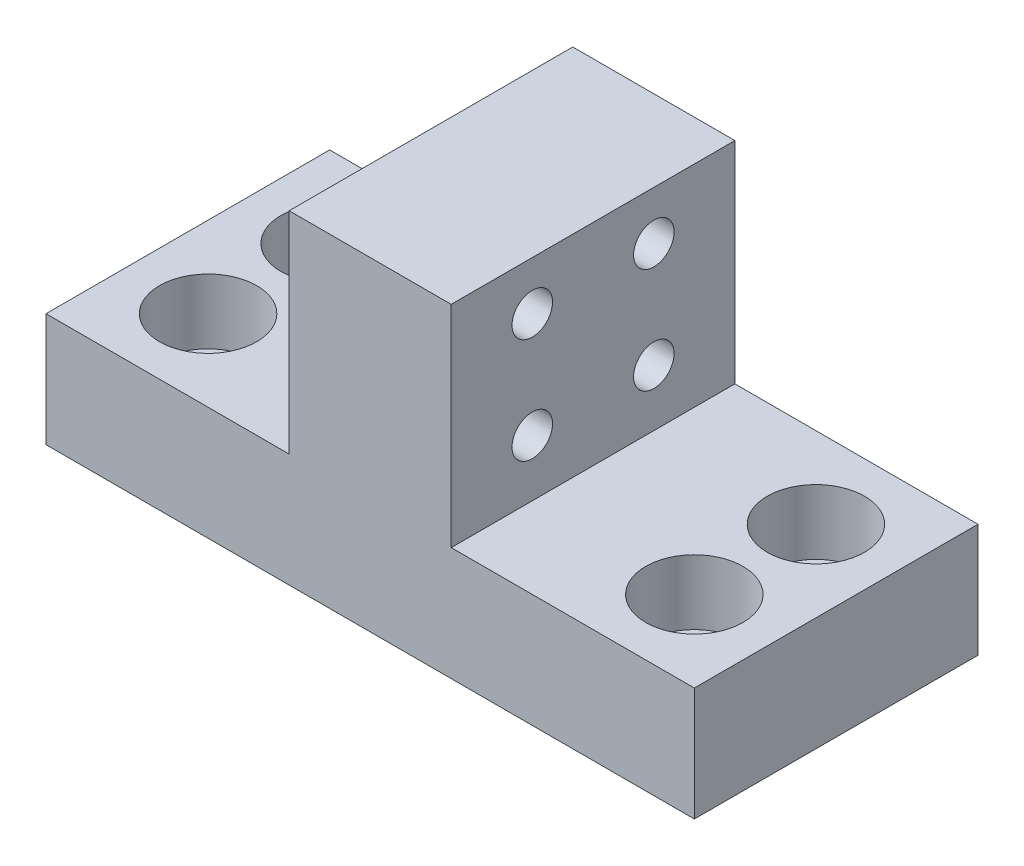
from build123d import *

# Parameters (mm, degrees)
SKETCH_1_W                    = 80
SKETCH_1_H                    = 35
EXTRUDE_1_DEPTH               = 14
SKETCH_2_W                    = 20
SKETCH_2_H                    = 35
EXTRUDE_2_DEPTH               = 26
HOLE_WIZARD_M20_1_D           = 7
HOLE_WIZARD_M20_1_CBORE_D     = 12
HOLE_WIZARD_M20_1_CBORE_DEPTH = 8
PATTERN_LINEAR_1_COUNT        = 2
PATTERN_LINEAR_1_PITCH        = 60
PATTERN_LINEAR_1_COUNT_DIR2   = 2
PATTERN_LINEAR_1_PITCH_DIR2   = 15
SKETCH_5_R                    = 2.5
CUT_EXTRUDE_1_DEPTH           = 67.379590237
PATTERN_LINEAR_2_COUNT        = 2
PATTERN_LINEAR_2_PITCH        = 15
PATTERN_LINEAR_2_COUNT_DIR2   = 2
PATTERN_LINEAR_2_PITCH_DIR2   = 13


with BuildPart() as part:
    # 草图1 → 凸台-拉伸1 (new body)
    with BuildSketch(Plane(origin=(0, 0, 0), x_dir=(1, 0, 0), z_dir=(0, 1, 0))):
        Rectangle(SKETCH_1_W, SKETCH_1_H)
    extrude(amount=EXTRUDE_1_DEPTH)

    # 草图2 → 凸台-拉伸2 (add)
    with BuildSketch(Plane(origin=(0, 14, 0), x_dir=(1, 0, 0), z_dir=(0, 1, 0))):
        Rectangle(SKETCH_2_W, SKETCH_2_H)
    extrude(amount=EXTRUDE_2_DEPTH)

    # M20 六角头螺栓的柱形沉头孔1 (through all)
    with Locations(Plane(origin=(0, 14, 0), x_dir=(1, 0, 0), z_dir=(0, 1, 0))):
        with Locations((-30, 7.5)):
            hole_wizard_m20_1 = CounterBoreHole(HOLE_WIZARD_M20_1_D / 2, HOLE_WIZARD_M20_1_CBORE_D / 2, HOLE_WIZARD_M20_1_CBORE_DEPTH)

    # 阵列(线性)1: Hole Wizard M20 _1 2 × 2
    with Locations(*[(i * PATTERN_LINEAR_1_PITCH, 0, j * PATTERN_LINEAR_1_PITCH_DIR2) for i in range(PATTERN_LINEAR_1_COUNT) for j in range(PATTERN_LINEAR_1_COUNT_DIR2) if (i, j) != (0, 0)]):
        add(hole_wizard_m20_1, mode=Mode.SUBTRACT)

    # 草图5 → 切除-拉伸1 (cut, through all)
    with BuildSketch(Plane.ZY.offset(10)):
        with Locations((-7.5, 21)):
            Circle(SKETCH_5_R)
    cut_extrude_1 = extrude(amount=-CUT_EXTRUDE_1_DEPTH, mode=Mode.SUBTRACT)

    # 阵列(线性)2: Cut-Extrude 1 2 × 2
    with Locations(*[(0, j * PATTERN_LINEAR_2_PITCH_DIR2, i * PATTERN_LINEAR_2_PITCH) for i in range(PATTERN_LINEAR_2_COUNT) for j in range(PATTERN_LINEAR_2_COUNT_DIR2) if (i, j) != (0, 0)]):
        add(cut_extrude_1, mode=Mode.SUBTRACT)


solid = part.part
